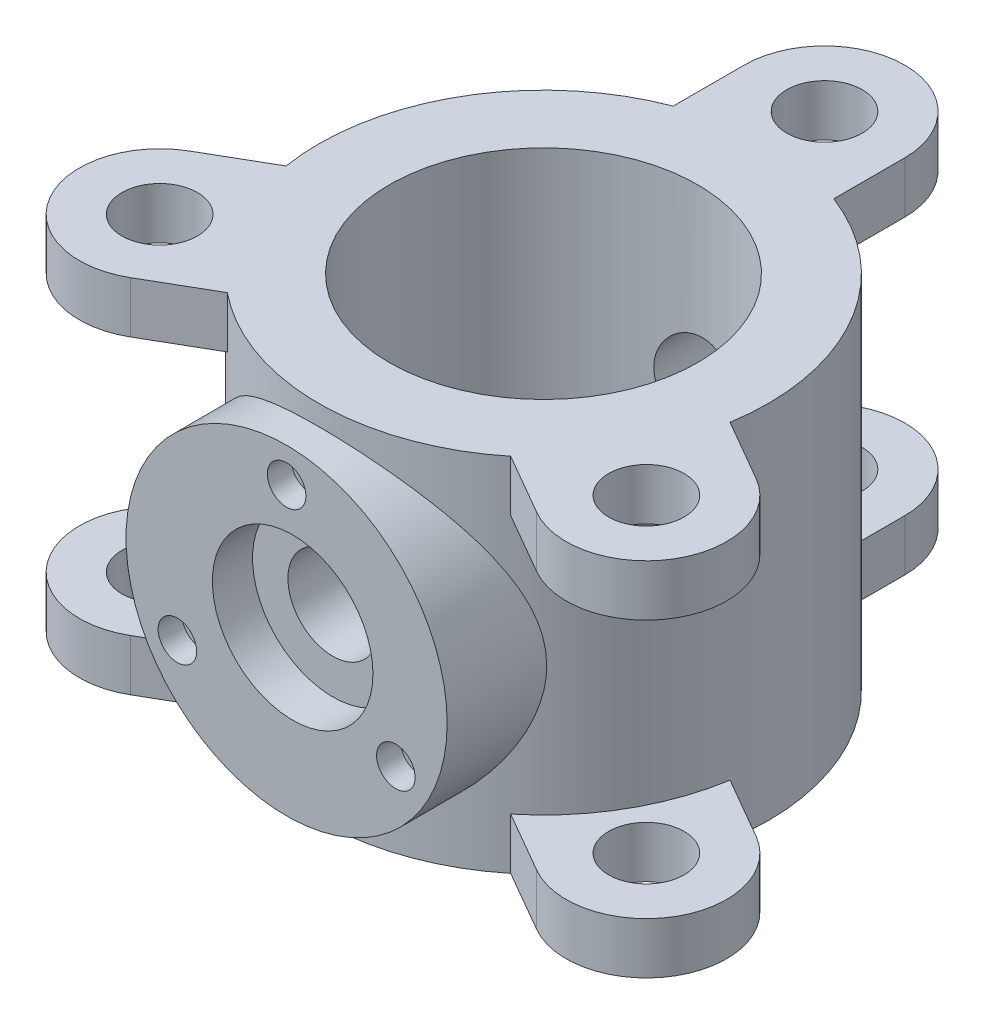
from build123d import *

# Parameters (mm, degrees)
SKETCH1_R                = 140
SKETCH1_R_2              = 96
BOSS_EXTRUDE1_DEPTH      = 225
SKETCH2_R                = 23.5
BOSS_EXTRUDE2_DEPTH      = 32
CIRPATTERN1_COUNT        = 3
MIRROR1_COPY_1_SKETCH_R  = 23.5
MIRROR1_COPY_1_DEPTH     = 32
MIRROR1_COPY_2_SKETCH_R  = 23.5
MIRROR1_COPY_2_DEPTH     = 32
BOSS_EXTRUDE3_REACH      = 491.361
BOSS_EXTRUDE3_END_RADIUS = 140
SKETCH3_R                = 100
SKETCH4_R                = 50
CUT_EXTRUDE1_DEPTH       = 25
SKETCH5_R                = 28
CUT_EXTRUDE2_DEPTH       = 470.945948606
SKETCH7_R                = 12
CUT_EXTRUDE3_DEPTH       = 15
CIRPATTERN2_COUNT        = 3


with BuildPart() as part:
    # Sketch1 → Boss-Extrude1 (new body)
    with BuildSketch(Plane(origin=(0, 0, 0), x_dir=(1, 0, 0), z_dir=(0, 1, 0))):
        with Locations(Location((0, 0, 0), (0, 0, 270))):
            Circle(SKETCH1_R)
        with Locations(Location((0, 0, 0), (0, 0, 270))):
            Circle(SKETCH1_R_2, mode=Mode.SUBTRACT)
    extrude(amount=BOSS_EXTRUDE1_DEPTH)

    # Sketch2 → Boss-Extrude2 (add)
    with BuildSketch(Plane(origin=(0, 225, 0), x_dir=(1, 0, 0), z_dir=(0, 1, 0))):
        with BuildLine():
            Line((50, 175), (50, 130.766968306))
            Line((50, 130.766968306), (-50, 130.766968306))
            Line((-50, 130.766968306), (-50, 175))
            ThreePointArc((-50, 175), (0, 225), (50, 175))
        make_face()
        with Locations(Location((0, 175, 0), (0, 0, 270))):
            Circle(SKETCH2_R, mode=Mode.SUBTRACT)
    boss_extrude2 = extrude(amount=-BOSS_EXTRUDE2_DEPTH)

    # CirPattern1: Boss-Extrude2 ×3 about axis
    cirpattern1_axis = Axis((0, 0, 0), (0, 1, 0))
    for i in range(1, CIRPATTERN1_COUNT):
        add(boss_extrude2.rotate(cirpattern1_axis, i * 360 / CIRPATTERN1_COUNT))

    # Mirror1: Boss-Extrude2 across plane
    add(boss_extrude2.mirror(Plane.ZX.offset(112.5)))

    # Mirror1 copy 1 sketch → Mirror1 copy 1 (add)
    with BuildSketch(Plane(origin=(0, 0, 0), x_dir=(-0.4999999999999998, 0, -0.8660254037844387), z_dir=(0, -1, 0))):
        with BuildLine():
            Line((50, -175), (50, -130.766968306))
            Line((50, -130.766968306), (-50, -130.766968306))
            Line((-50, -130.766968306), (-50, -175))
            ThreePointArc((-50, -175), (0, -225), (50, -175))
        make_face()
        with Locations((0, -175)):
            Circle(MIRROR1_COPY_1_SKETCH_R, mode=Mode.SUBTRACT)
    extrude(amount=-MIRROR1_COPY_1_DEPTH)

    # Mirror1 copy 2 sketch → Mirror1 copy 2 (add)
    with BuildSketch(Plane(origin=(0, 0, 0), x_dir=(-0.5000000000000004, 0, 0.8660254037844384), z_dir=(0, -1, 0))):
        with BuildLine():
            Line((50, -175), (50, -130.766968306))
            Line((50, -130.766968306), (-50, -130.766968306))
            Line((-50, -130.766968306), (-50, -175))
            ThreePointArc((-50, -175), (0, -225), (50, -175))
        make_face()
        with Locations((0, -175)):
            Circle(MIRROR1_COPY_2_SKETCH_R, mode=Mode.SUBTRACT)
    extrude(amount=-MIRROR1_COPY_2_DEPTH)

    # Boss-Extrude3: up to this cylinder (the profile starts outside it)
    boss_extrude3_end = Plane(origin=(0, 112.5, 0), z_dir=(0, -1, 0)) * Cylinder(BOSS_EXTRUDE3_END_RADIUS, 1263.722, mode=Mode.PRIVATE)
    # Sketch3 → Boss-Extrude3 (add, up to the surface)
    with BuildSketch(Plane.XY.offset(160), mode=Mode.PRIVATE) as boss_extrude3_sk1:
        with Locations((0, 112.5)):
            Circle(SKETCH3_R)
    boss_extrude3_tool1 = extrude(boss_extrude3_sk1.sketch, amount=-BOSS_EXTRUDE3_REACH, mode=Mode.PRIVATE) - boss_extrude3_end
    add(boss_extrude3_tool1.solids().sort_by_distance((0, 112.5, 160))[0])

    # Sketch4 → Cut-Extrude1 (cut)
    with BuildSketch(Plane.XY.offset(160)):
        with Locations((3.778615411, 116.042451948)):
            Circle(SKETCH4_R)
    extrude(amount=-CUT_EXTRUDE1_DEPTH, mode=Mode.SUBTRACT)

    # Sketch5 → Cut-Extrude2 (cut, through all)
    with BuildSketch(Plane.XY.offset(135)):
        with Locations((3.778615411, 116.042451948)):
            Circle(SKETCH5_R)
    extrude(amount=-CUT_EXTRUDE2_DEPTH, mode=Mode.SUBTRACT)

    # Sketch7 → Cut-Extrude3 (cut)
    with BuildSketch(Plane.XY.offset(160)):
        with Locations((0, 191.042451948)):
            Circle(SKETCH7_R)
    cut_extrude3 = extrude(amount=-CUT_EXTRUDE3_DEPTH, mode=Mode.SUBTRACT)

    # CirPattern2: Cut-Extrude3 ×3 about axis
    cirpattern2_axis = Axis((0, 112.5, 0), (0, 0, 1))
    for i in range(1, CIRPATTERN2_COUNT):
        add(cut_extrude3.rotate(cirpattern2_axis, i * 360 / CIRPATTERN2_COUNT), mode=Mode.SUBTRACT)


solid = part.part
